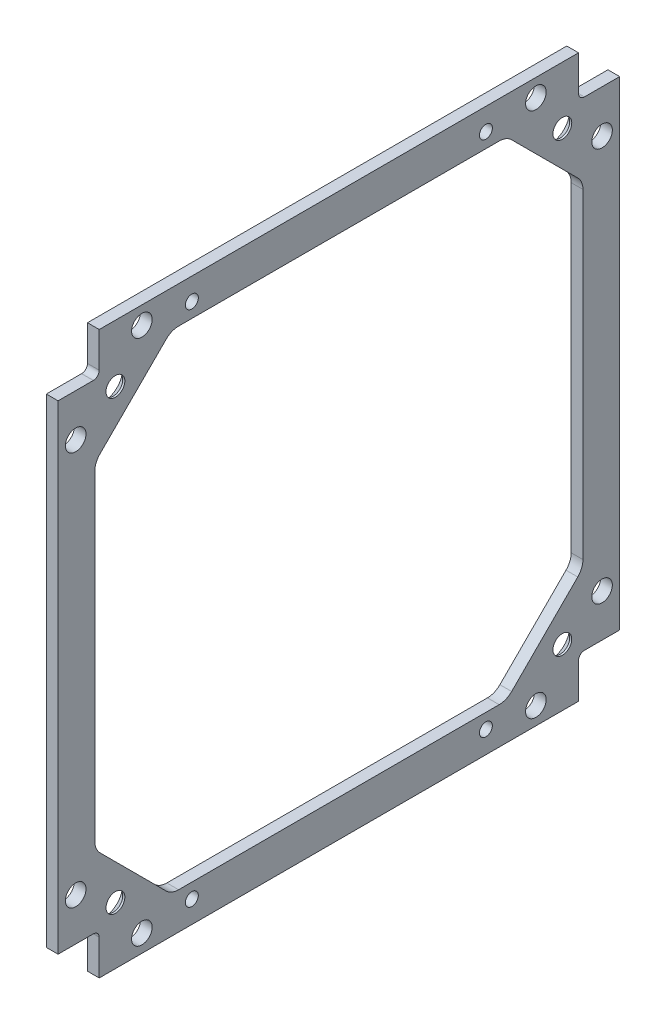
from build123d import *

# Parameters (mm, degrees)
BOSS_EXTRUDE2_DEPTH                          = 2
F_3_5_3_5_DIAMETER_HOLE1_D                   = 3.5
CSK_FOR_M3_FLAT_COUNTERSUNK_HEAD_SCR_2_COUNT = 2
CSK_FOR_M3_FLAT_COUNTERSUNK_HEAD_SCR_2_PITCH = 76
CSK_FOR_M3_FLAT_COUNTERSUNK_HEAD_SCR_3_COUNT = 2
CSK_FOR_M3_FLAT_COUNTERSUNK_HEAD_SCR_3_PITCH = 107.48023074
CSK_FOR_M3_FLAT_COUNTERSUNK_HEAD_SCR_4_COUNT = 2
CSK_FOR_M3_FLAT_COUNTERSUNK_HEAD_SCR_4_PITCH = 76
F_2_2_2_2_DIAMETER_HOLE1_D                   = 2.2
FILLET1_R                                    = 3
FILLET2_R                                    = 1


with BuildPart() as part:
    # Sketch2 → Boss-Extrude2 (new body)
    with BuildSketch(Plane.ZY.offset(51.493641502)):
        Polygon((0.43465612, 3.95185693), (7.43465612, 3.95185693), (7.43465612, 85.45185693), (0.43465612, 85.45185693), (0.43465612, 92.45185693), (-81.06534388, 92.45185693), (-81.06534388, 85.45185693), (-88.06534388, 85.45185693), (-88.06534388, 3.95185693), (-81.06534388, 3.95185693), (-81.06534388, -3.04814307), (0.43465612, -3.04814307), align=None)
        Polygon((-81.81534388, 73.20185693), (-81.81534388, 16.20185693), (-68.81534388, 3.20185693), (-11.81534388, 3.20185693), (1.18465612, 16.20185693), (1.18465612, 73.20185693), (-11.81534388, 86.20185693), (-68.81534388, 86.20185693), align=None, mode=Mode.SUBTRACT)
    extrude(amount=BOSS_EXTRUDE2_DEPTH)

    # Ø3.5 (3.5) Diameter Hole1 (through all)
    with Locations(Plane.ZY.offset(53.493641502)):
        with Locations((-73.81534388, -0.04814307), (-85.06534388, 11.20185693), (-85.06534388, 78.20185693), (-73.81534388, 89.45185693), (-6.81534388, 89.45185693), (4.43465612, 78.20185693), (4.43465612, 11.20185693), (-6.81534388, -0.04814307)):
            Hole(F_3_5_3_5_DIAMETER_HOLE1_D / 2)

    # Sketch24 → CSK for M3 Flat Countersunk Head Screw5 (revolve, cut)
    with BuildSketch(Plane(origin=(-53.493641502, 6.70185693, -78.31534388), x_dir=(0, 0, 1), z_dir=(0, 1, 0))):
        Polygon((0, 0), (0, 2), (1.6, 2), (1.6, 1.65), (3.25, 0), align=None)
    csk_for_m3_flat_countersunk_head_screw5 = revolve(axis=Axis((-59.843641502, 6.70185693, -78.31534388), (1, 0, 0)), mode=Mode.SUBTRACT)

    # CSK for M3 Flat Countersunk Head Scr 2: CSK for M3 Flat Countersunk Head Screw5 ×2
    with Locations(*[(0, i * CSK_FOR_M3_FLAT_COUNTERSUNK_HEAD_SCR_2_PITCH, 0) for i in range(1, CSK_FOR_M3_FLAT_COUNTERSUNK_HEAD_SCR_2_COUNT)]):
        add(csk_for_m3_flat_countersunk_head_screw5, mode=Mode.SUBTRACT)

    # CSK for M3 Flat Countersunk Head Scr 3: CSK for M3 Flat Countersunk Head Screw5 ×2
    with Locations(*[Vector(0, 0.7071067811865476, 0.7071067811865475) * (i * CSK_FOR_M3_FLAT_COUNTERSUNK_HEAD_SCR_3_PITCH) for i in range(1, CSK_FOR_M3_FLAT_COUNTERSUNK_HEAD_SCR_3_COUNT)]):
        add(csk_for_m3_flat_countersunk_head_screw5, mode=Mode.SUBTRACT)

    # CSK for M3 Flat Countersunk Head Scr 4: CSK for M3 Flat Countersunk Head Screw5 ×2
    with Locations(*[(0, 0, i * CSK_FOR_M3_FLAT_COUNTERSUNK_HEAD_SCR_4_PITCH) for i in range(1, CSK_FOR_M3_FLAT_COUNTERSUNK_HEAD_SCR_4_COUNT)]):
        add(csk_for_m3_flat_countersunk_head_screw5, mode=Mode.SUBTRACT)

    # Ø2.2 (2.2) Diameter Hole1 (through all)
    with Locations(Plane(origin=(-53.493641502, 88.70185693, -65.31534388), x_dir=(0, 0, -1), z_dir=(-1, 0, 0))):
        with Locations((0, 0), (-50, 0), (0, 88), (-50, 88)):
            Hole(F_2_2_2_2_DIAMETER_HOLE1_D / 2)

    # Fillet1
    fillet1_edges = [part.edges().sort_by_distance(p)[0] for p in [
        (-52.493641502, 86.20185693, -68.81534388),
        (-52.493641502, 73.20185693, -81.81534388),
        (-52.493641502, 16.20185693, -81.81534388),
        (-52.493641502, 3.20185693, -68.81534388),
        (-52.493641502, 3.20185693, -11.81534388),
        (-52.493641502, 16.20185693, 1.18465612),
        (-52.493641502, 73.20185693, 1.18465612),
        (-52.493641502, 86.20185693, -11.81534388),
    ]]
    fillet(fillet1_edges, radius=FILLET1_R)

    # Fillet2
    fillet2_edges = [part.edges().sort_by_distance(p)[0] for p in [
        (-52.493641502, 3.95185693, -81.06534388),
        (-52.493641502, 85.45185693, -81.06534388),
        (-52.493641502, 85.45185693, 0.43465612),
        (-52.493641502, 3.95185693, 0.43465612),
    ]]
    fillet(fillet2_edges, radius=FILLET2_R)


solid = part.part
